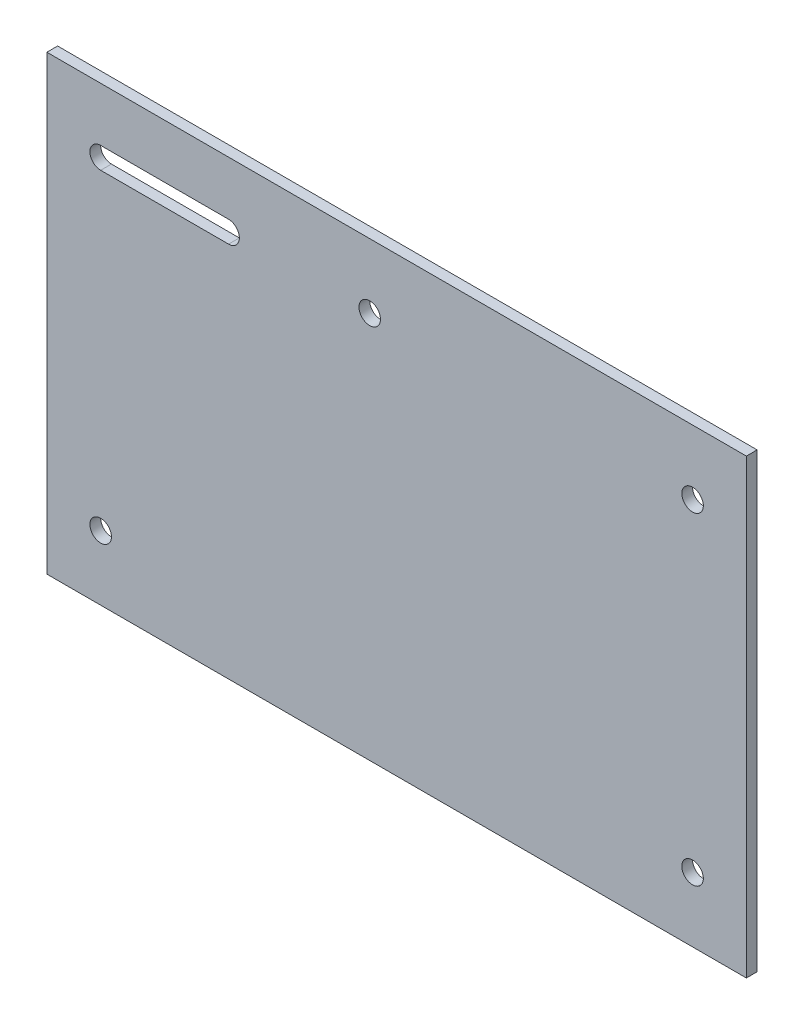
from build123d import *

# Parameters (mm, degrees)
SKETCH1_W           = 130
SKETCH1_H           = 84
BOSS_EXTRUDE1_DEPTH = 2
SKETCH2_R           = 2
CUT_EXTRUDE1_DEPTH  = 2
CUT_EXTRUDE2_DEPTH  = 2


with BuildPart() as part:
    # Sketch1 → Boss-Extrude1 (new body)
    with BuildSketch(Plane.XY):
        Rectangle(SKETCH1_W, SKETCH1_H)
    extrude(amount=BOSS_EXTRUDE1_DEPTH)

    # Sketch2 → Cut-Extrude1 (cut)
    with BuildSketch(Plane.XY.offset(2)):
        with Locations((55, -30)):
            Circle(SKETCH2_R)
        with Locations((-55, -30)):
            Circle(SKETCH2_R)
        with Locations((55, 30)):
            Circle(SKETCH2_R)
        with Locations((-5, 30)):
            Circle(SKETCH2_R)
    extrude(amount=-CUT_EXTRUDE1_DEPTH, mode=Mode.SUBTRACT)

    # Sketch3 → Cut-Extrude2 (cut)
    with BuildSketch(Plane.XY.offset(2)):
        with BuildLine():
            Line((-55, 32), (-31.229864945, 32))
            ThreePointArc((-31.229864945, 32), (-29.229864945, 30), (-31.229864945, 28))
            Line((-31.229864945, 28), (-55, 28))
            ThreePointArc((-55, 28), (-57, 30), (-55, 32))
        make_face()
    extrude(amount=-CUT_EXTRUDE2_DEPTH, mode=Mode.SUBTRACT)


solid = part.part
